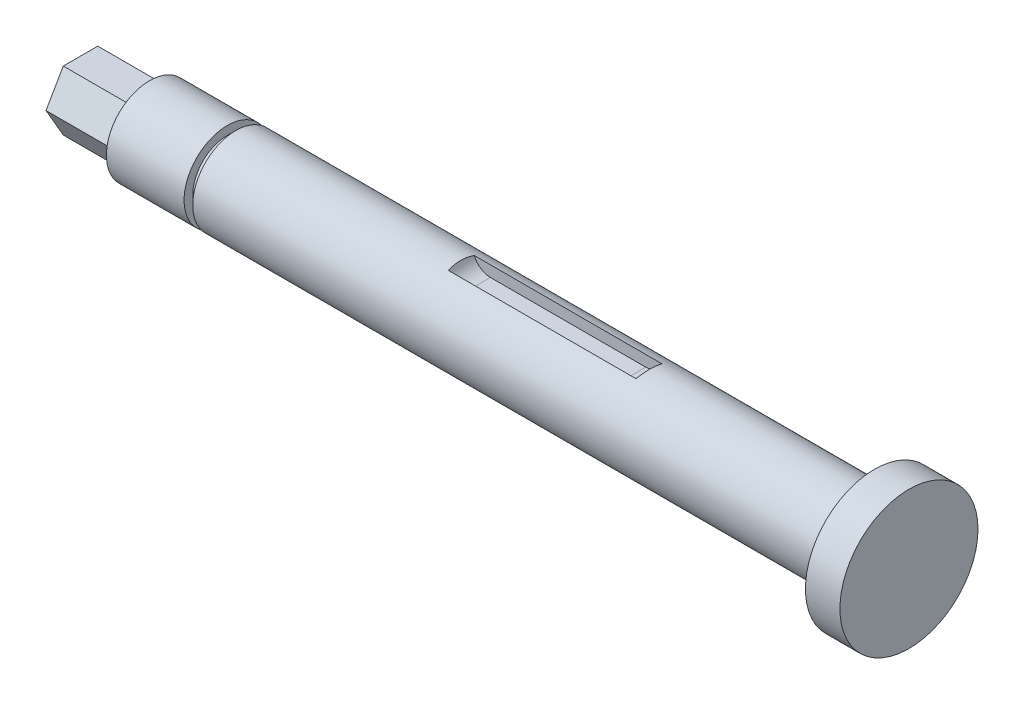
from build123d import *

# Parameters (mm, degrees)
KEYWAY_DEPTH       = 2.38125
SKETCH3_OUTSIDE_W  = 58.716
SKETCH3_OUTSIDE_H  = 58.716
CUT_EXTRUDE2_DEPTH = 12.7


with BuildPart() as part:
    # Sketch1 → Base (revolve)
    with BuildSketch(Plane.XY, mode=Mode.PRIVATE) as base_sk:
        Polygon((0, 0), (0, 6.35), (12.7, 6.35), (12.7, 7.9375), (26.9875, 7.9375), (26.9875, 6.35), (28.575, 6.35), (28.575, 7.9375), (146.05, 7.9375), (146.05, 12.7), (152.4, 12.7), (152.4, 0), align=None)
    revolve(base_sk.sketch.rotate(Axis((0, 0, 0), (-1, 0, 0)), 90), axis=Axis((0, 0, 0), (-1, 0, 0)))

    # Sketch2 → Keyway (cut, symmetric)
    with BuildSketch(Plane.XY):
        with BuildLine():
            Line((69.85, 14.2875), (69.85, 8.7249))
            ThreePointArc((69.85, 8.7249), (70.77993597, 6.47983597), (73.025, 5.5499))
            Line((73.025, 5.5499), (101.6, 5.5499))
            ThreePointArc((101.6, 5.5499), (103.84506403, 6.47983597), (104.775, 8.7249))
            Line((104.775, 8.7249), (104.775, 14.2875))
            Line((104.775, 14.2875), (69.85, 14.2875))
        make_face()
    extrude(amount=KEYWAY_DEPTH, both=True, mode=Mode.SUBTRACT)

    # Sketch3 outside → Cut-Extrude2 (cut)
    with BuildSketch(Plane.ZY):
        Rectangle(SKETCH3_OUTSIDE_W, SKETCH3_OUTSIDE_H)
        Polygon((3.175, 5.499261314), (-3.175, 5.499261314), (-6.35, 0), (-3.175, -5.499261314), (3.175, -5.499261314), (6.35, 0), align=None, mode=Mode.SUBTRACT)
    extrude(amount=-CUT_EXTRUDE2_DEPTH, mode=Mode.SUBTRACT)


solid = part.part
